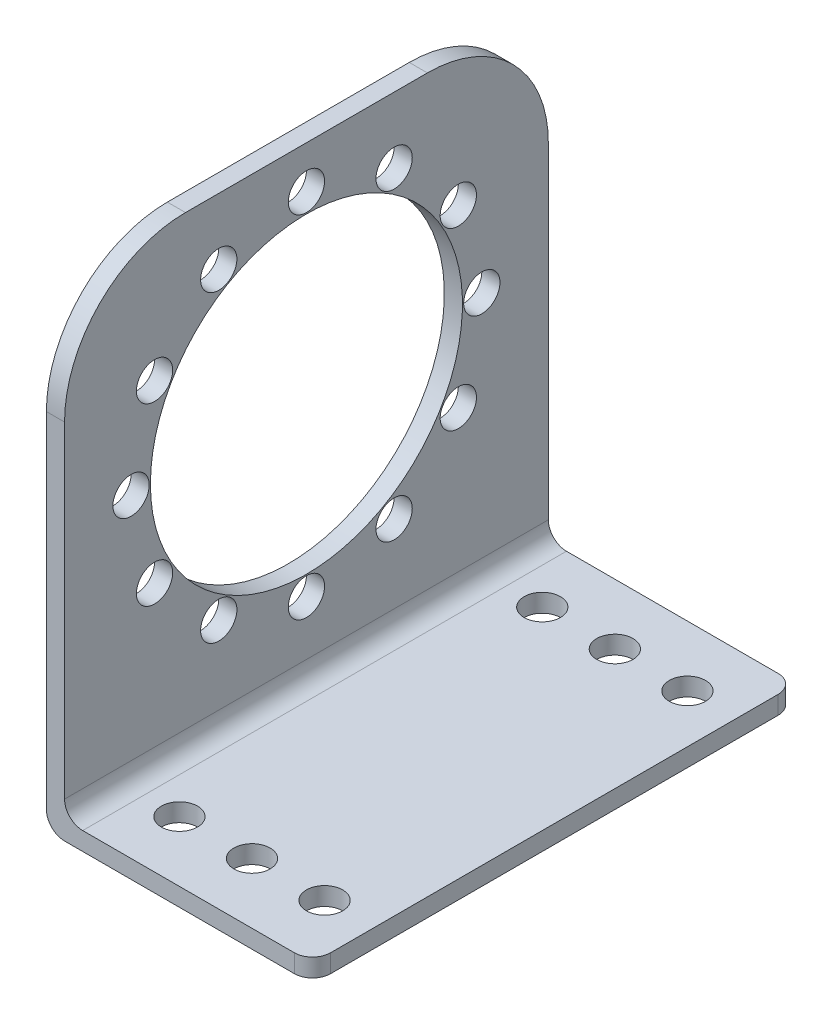
from build123d import *

# Parameters (mm, degrees)
SKETCH1_W           = 1.5
SKETCH1_H           = 40
BOSS_EXTRUDE1_DEPTH = 40
SKETCH2_W           = 40
SKETCH2_H           = 1.5
BOSS_EXTRUDE2_DEPTH = 20.5
SKETCH3_R           = 1.5
CUT_EXTRUDE1_DEPTH  = 20.5
FILLET5_R           = 1.5
FILLET6_R           = 1.5
FILLET7_R           = 10
FILLET8_R           = 10
FILLET9_R           = 1.5
FILLET10_R          = 1.5
SKETCH6_R           = 1.5
CUT_EXTRUDE2_DEPTH  = 4
SKETCH7_R           = 12.9
CUT_EXTRUDE5_DEPTH  = 4


with BuildPart() as part:
    # Sketch1 → Boss-Extrude1 (new body)
    with BuildSketch(Plane(origin=(0, 0, 0), x_dir=(1, 0, 0), z_dir=(0, 1, 0))):
        with Locations((0.75, -20)):
            Rectangle(SKETCH1_W, SKETCH1_H)
    extrude(amount=BOSS_EXTRUDE1_DEPTH)

    # Sketch2 → Boss-Extrude2 (add)
    with BuildSketch(Plane(origin=(1.5, 0, 0), x_dir=(0, 0, -1), z_dir=(1, 0, 0))):
        with Locations((-20, 0.75)):
            Rectangle(SKETCH2_W, SKETCH2_H)
    extrude(amount=BOSS_EXTRUDE2_DEPTH)

    # Sketch3 → Cut-Extrude1 (cut)
    with BuildSketch(Plane(origin=(0, 1.5, 0), x_dir=(1, 0, 0), z_dir=(0, 1, 0))):
        with Locations(Location((6, -5, 0), (0, 0, 270))):
            Circle(SKETCH3_R)
        with Locations(Location((6, -35, 0), (0, 0, 270))):
            Circle(SKETCH3_R)
        with Locations(Location((12, -35, 0), (0, 0, 270))):
            Circle(SKETCH3_R)
        with Locations(Location((12, -5, 0), (0, 0, 270))):
            Circle(SKETCH3_R)
        with Locations(Location((18, -5, 0), (0, 0, 270))):
            Circle(SKETCH3_R)
        with Locations(Location((18, -35, 0), (0, 0, 270))):
            Circle(SKETCH3_R)
    extrude(amount=-CUT_EXTRUDE1_DEPTH, mode=Mode.SUBTRACT)

    # Fillet5
    fillet5_edges = [part.edges().sort_by_distance(p)[0] for p in [
        (0, 0, 20),
    ]]
    fillet(fillet5_edges, radius=FILLET5_R)

    # Fillet6
    fillet6_edges = [part.edges().sort_by_distance(p)[0] for p in [
        (1.5, 1.5, 20),
    ]]
    fillet(fillet6_edges, radius=FILLET6_R)

    # Fillet7
    fillet7_edges = [part.edges().sort_by_distance(p)[0] for p in [
        (0.75, 40, 40),
    ]]
    fillet(fillet7_edges, radius=FILLET7_R)

    # Fillet8
    fillet8_edges = [part.edges().sort_by_distance(p)[0] for p in [
        (0.75, 40, 0),
    ]]
    fillet(fillet8_edges, radius=FILLET8_R)

    # Fillet9
    fillet9_edges = [part.edges().sort_by_distance(p)[0] for p in [
        (22, 0.75, 40),
    ]]
    fillet(fillet9_edges, radius=FILLET9_R)

    # Fillet10
    fillet10_edges = [part.edges().sort_by_distance(p)[0] for p in [
        (22, 0.75, 0),
    ]]
    fillet(fillet10_edges, radius=FILLET10_R)

    # Sketch6 → Cut-Extrude2 (cut)
    with BuildSketch(Plane(origin=(1.5, 0, 0), x_dir=(0, 0, -1), z_dir=(1, 0, 0))):
        with Locations((-20, 36.5)):
            Circle(SKETCH6_R)
        with Locations((-12.75, 34.557368355)):
            Circle(SKETCH6_R)
        with Locations((-7.442631645, 29.25)):
            Circle(SKETCH6_R)
        with Locations((-5.5, 22)):
            Circle(SKETCH6_R)
        with Locations((-7.442631645, 14.75)):
            Circle(SKETCH6_R)
        with Locations((-12.75, 9.442631645)):
            Circle(SKETCH6_R)
        with Locations((-20, 7.5)):
            Circle(SKETCH6_R)
        with Locations((-27.25, 9.442631645)):
            Circle(SKETCH6_R)
        with Locations((-32.557368355, 14.75)):
            Circle(SKETCH6_R)
        with Locations((-34.5, 22)):
            Circle(SKETCH6_R)
        with Locations((-32.557368355, 29.25)):
            Circle(SKETCH6_R)
        with Locations((-27.25, 34.557368355)):
            Circle(SKETCH6_R)
    extrude(amount=-CUT_EXTRUDE2_DEPTH, mode=Mode.SUBTRACT)

    # Sketch7 → Cut-Extrude5 (cut)
    with BuildSketch(Plane.ZY):
        with Locations((20, 22)):
            Circle(SKETCH7_R)
    extrude(amount=-CUT_EXTRUDE5_DEPTH, mode=Mode.SUBTRACT)


solid = part.part
